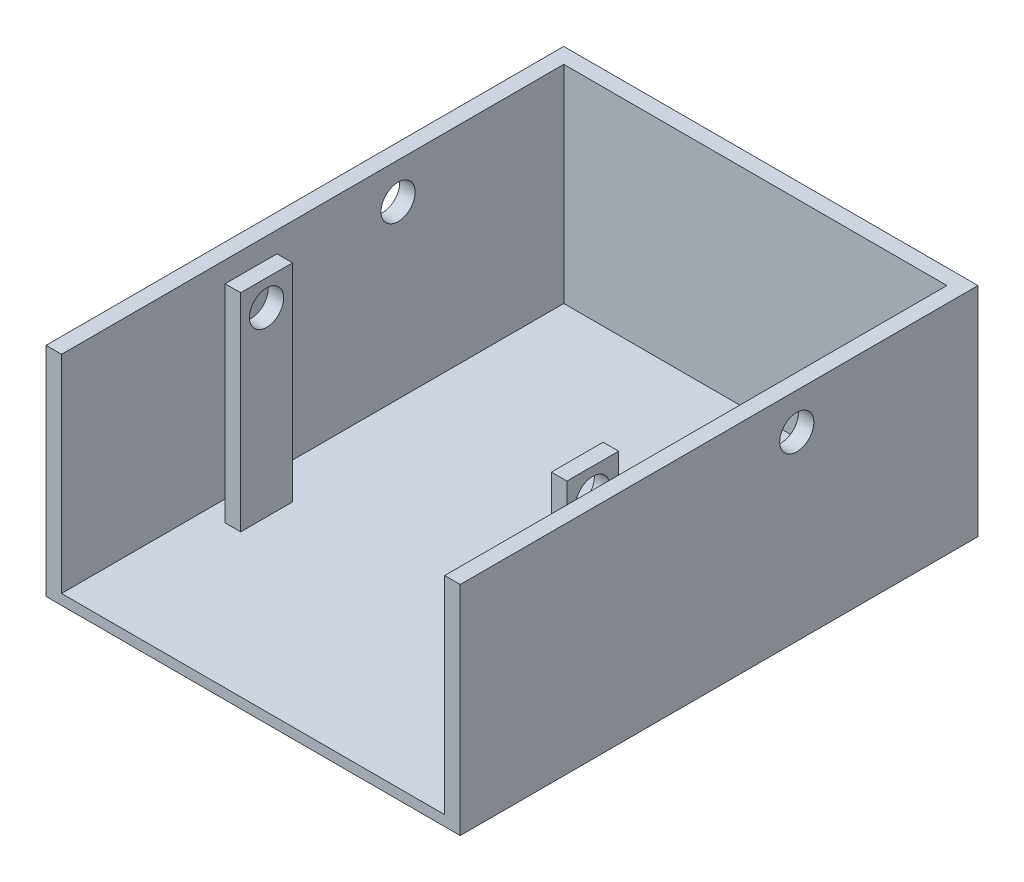
from build123d import *

# Parameters (mm, degrees)
SKETCH3_W               = 400
SKETCH3_H               = 500
BOSS_EXTRUDE1_DEPTH     = 10
BOSS_EXTRUDE3_DEPTH     = 200
CUT_EXTRUDE1_DEPTH      = 517.333225737
CUT_EXTRUDE1_DEPTH_BACK = 517.333225737
SKETCH5_R               = 16.5
SKETCH6_W               = 15
SKETCH6_H               = 50
BOSS_EXTRUDE4_DEPTH     = 200
SKETCH9_R               = 16.5
CUT_EXTRUDE3_DEPTH      = 15
SKETCH10_R              = 16.5
CUT_EXTRUDE4_DEPTH      = 15


with BuildPart() as part:
    # Sketch3 → Boss-Extrude1 (new body)
    with BuildSketch(Plane(origin=(0, 0, 0), x_dir=(1, 0, 0), z_dir=(0, 1, 0))):
        Rectangle(SKETCH3_W, SKETCH3_H)
    extrude(amount=BOSS_EXTRUDE1_DEPTH)

    # Sketch4 → Boss-Extrude3 (add)
    with BuildSketch(Plane(origin=(0, 10, 0), x_dir=(1, 0, 0), z_dir=(0, 1, 0))):
        Polygon((-185, -250), (-185, -235), (-185, 235), (185, 235), (185, -235), (185, -250), (200, -250), (200, 250), (-200, 250), (-200, -250), align=None)
    extrude(amount=BOSS_EXTRUDE3_DEPTH)

    # Sketch5 → Cut-Extrude1 (cut, two sides: drawn at the far end of the back side and taken through both)
    with BuildSketch(Plane.ZY.offset(200).offset(-CUT_EXTRUDE1_DEPTH_BACK)):
        with Locations(Location((-75, 175, 0), (0, 0, 180))):
            Circle(SKETCH5_R)
    extrude(amount=CUT_EXTRUDE1_DEPTH + CUT_EXTRUDE1_DEPTH_BACK, mode=Mode.SUBTRACT)

    # Sketch6 → Boss-Extrude4 (add)
    with BuildSketch(Plane(origin=(0, 10, 0), x_dir=(1, 0, 0), z_dir=(0, 1, 0))):
        with Locations((-157.5, -87)):
            Rectangle(SKETCH6_W, SKETCH6_H)
        with Locations((157.5, -87)):
            Rectangle(SKETCH6_W, SKETCH6_H)
    extrude(amount=BOSS_EXTRUDE4_DEPTH)

    # Sketch9 → Cut-Extrude3 (cut)
    with BuildSketch(Plane(origin=(-150, 0, 0), x_dir=(0, 0, -1), z_dir=(1, 0, 0))):
        with Locations((-87, 185)):
            Circle(SKETCH9_R)
    extrude(amount=-CUT_EXTRUDE3_DEPTH, mode=Mode.SUBTRACT)

    # Sketch10 → Cut-Extrude4 (cut)
    with BuildSketch(Plane(origin=(165, 0, 0), x_dir=(0, 0, -1), z_dir=(1, 0, 0))):
        with Locations((-87, 185)):
            Circle(SKETCH10_R)
    extrude(amount=-CUT_EXTRUDE4_DEPTH, mode=Mode.SUBTRACT)


solid = part.part
